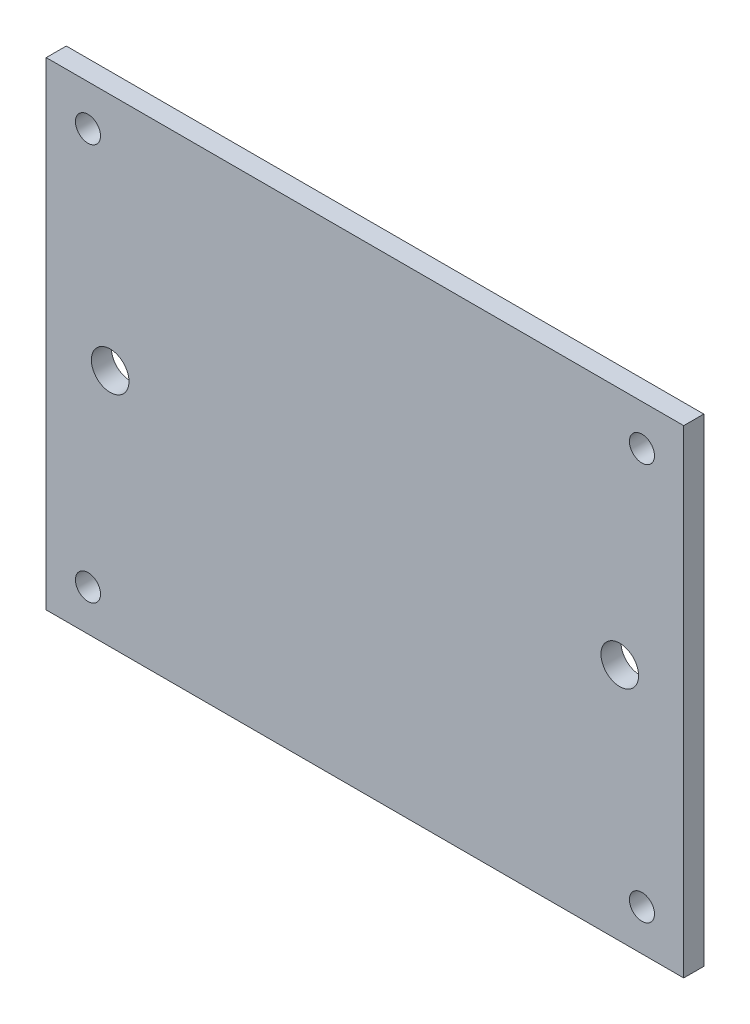
from build123d import *

# Parameters (mm, degrees)
SKETCH1_W           = 50.84
SKETCH1_H           = 38.15
SKETCH1_R           = 1
SKETCH1_R_2         = 1.5
BOSS_EXTRUDE1_DEPTH = 1.6


with BuildPart() as part:
    # Sketch1 → Boss-Extrude1 (new body)
    with BuildSketch(Plane.XY):
        Rectangle(SKETCH1_W, SKETCH1_H)
        with Locations((-22.09, 15.825)):
            Circle(SKETCH1_R, mode=Mode.SUBTRACT)
        with Locations(Location((22.09, 15.825, 0), (0, 0, 180))):
            Circle(SKETCH1_R, mode=Mode.SUBTRACT)
        with Locations((22.09, -15.825)):
            Circle(SKETCH1_R, mode=Mode.SUBTRACT)
        with Locations(Location((-22.09, -15.825, 0), (0, 0, 180))):
            Circle(SKETCH1_R, mode=Mode.SUBTRACT)
        with Locations((-20.32, 0)):
            Circle(SKETCH1_R_2, mode=Mode.SUBTRACT)
        with Locations(Location((20.32, 0, 0), (0, 0, 180))):
            Circle(SKETCH1_R_2, mode=Mode.SUBTRACT)
    extrude(amount=BOSS_EXTRUDE1_DEPTH)


solid = part.part
